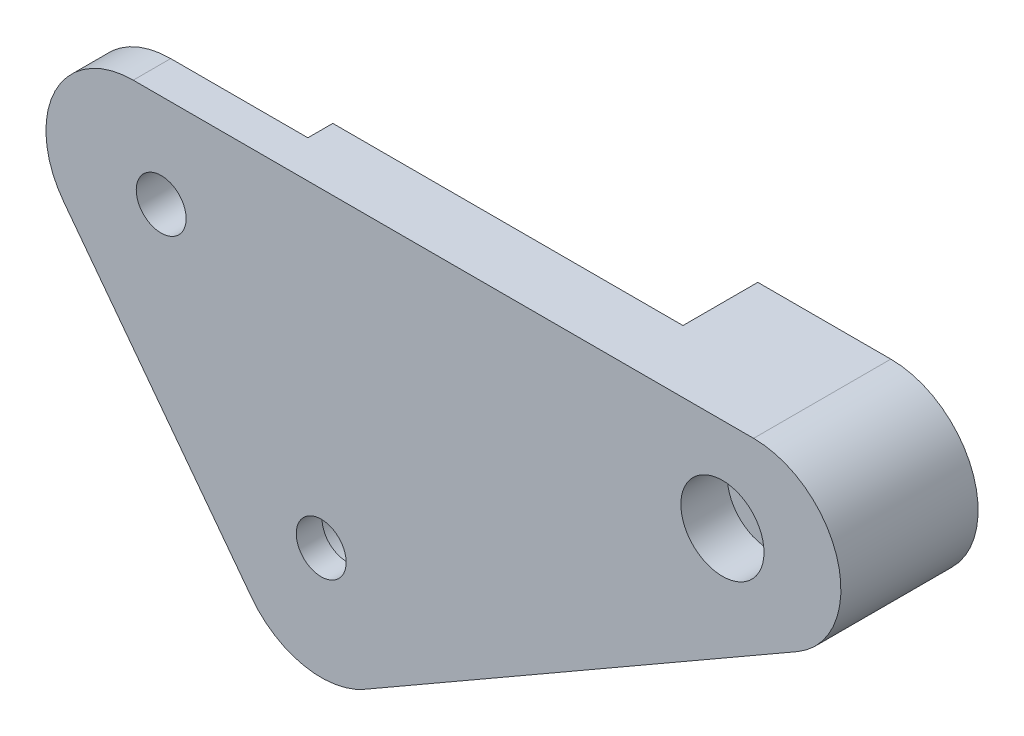
from build123d import *
from build123d.topology import SkipClean

# Parameters (mm, degrees)
SKETCH_1_R          = 3.333333333
SKETCH_1_R_2        = 5
EXTRUDE_1_DEPTH     = 5
EXTRUDE_START       = 6
SKETCH_6_R          = 5
EXTRUDE_5_DEPTH     = 6
EXTRUDE_START_2     = 2
SKETCH_7_R          = 2
EXTRUDE_6_DEPTH     = 2
SKETCH_9_R          = 2
CUT_EXTRUDE_3_DEPTH = 79.745912397
EXTRUDE_START_3     = -11
SKETCH_10_R         = 5
SKETCH_10_R_2       = 2
EXTRUDE_7_DEPTH     = 11
FILLET_2_R          = 10
SCALE_1_SCALE       = 1.5
SKETCH_11_R         = 3
CUT_EXTRUDE_4_DEPTH = 6
EXTRUDE_START_4     = -15
SKETCH_12_R         = 3
SKETCH_12_R_2       = 2.6
EXTRUDE_8_DEPTH     = 15
SKETCH_13_R         = 5
CUT_EXTRUDE_5_DEPTH = 5.6
EXTRUDE_START_5     = -4.4
SKETCH_15_R         = 5
SKETCH_15_R_2       = 3
EXTRUDE_9_DEPTH     = 3.1
SKETCH_16_R         = 6
CUT_EXTRUDE_6_DEPTH = 0.4


with BuildPart() as part:
    # 草图1 → 凸台-拉伸1 (new body)
    with BuildSketch(Plane.XY):
        with BuildLine():
            Line((14.059772875, 0), (63.798276921, 0))
            ThreePointArc((63.798276921, 0), (70.56109353, -5.193259423), (67.289321258, -13.067339568))
            Line((67.289321258, -13.067339568), (32.61880944, -33.016164352))
            ThreePointArc((32.61880944, -33.016164352), (27.731011729, -33.808057978), (23.542094163, -31.167862607))
            Line((23.542094163, -31.167862607), (8.474101936, -11.219037824))
            ThreePointArc((8.474101936, -11.219037824), (7.793463564, -3.88016545), (14.059772875, 0))
        make_face()
        with Locations((29.127765103, -24.948824784)):
            Circle(SKETCH_1_R, mode=Mode.SUBTRACT)
        with Locations((61.298276921, -7.5)):
            Circle(SKETCH_1_R_2, mode=Mode.SUBTRACT)
    extrude(amount=EXTRUDE_1_DEPTH)

    # 草图6 → 凸台-拉伸5 (add)
    with SkipClean():  # the faces are left unmerged after this step: merging them gives an invalid solid
        with BuildSketch(Plane(origin=(0, 0, 0), x_dir=(-1, 0, 0), z_dir=(0, 0, -1)).offset(EXTRUDE_START)):
            with BuildLine():
                Line((-67.289321258, -13.067339568), (-55.111154239, -20.074450433))
                Line((-55.111154239, -20.074450433), (-49.187018483, -12.783115053))
                Line((-49.187018483, -12.783115053), (-53.134085027, 0))
                Line((-53.134085027, 0), (-63.798276921, 0))
                ThreePointArc((-63.798276921, 0), (-70.56109353, -5.193259423), (-67.289321258, -13.067339568))
            make_face()
            with Locations((-61.298276921, -7.5)):
                Circle(SKETCH_6_R, mode=Mode.SUBTRACT)
        extrude(amount=-EXTRUDE_5_DEPTH)

    # 草图7 → 凸台-拉伸6 (add)
    with SkipClean():  # the faces are left unmerged after this step: merging them gives an invalid solid
        with BuildSketch(Plane(origin=(0, 0, 0), x_dir=(-1, 0, 0), z_dir=(0, 0, -1)).offset(EXTRUDE_START_2)):
            with BuildLine():
                Line((-14.059772875, 0), (-25.059772875, 0))
                Line((-25.059772875, 0), (-26.163863889, -10))
                Line((-26.163863889, -10), (-13.040056703, -17.263999238))
                Line((-13.040056703, -17.263999238), (-8.474101936, -11.219037824))
                ThreePointArc((-8.474101936, -11.219037824), (-7.793463564, -3.88016545), (-14.059772875, 0))
            make_face()
            with Locations((-16.298276921, -7.5)):
                Circle(SKETCH_7_R, mode=Mode.SUBTRACT)
        extrude(amount=-EXTRUDE_6_DEPTH)

    # 草图9 → 切除-拉伸3 (cut, through all)
    with SkipClean():  # the faces are left unmerged after this step: merging them gives an invalid solid
        with BuildSketch(Plane(origin=(0, 0, 0), x_dir=(-1, 0, 0), z_dir=(0, 0, -1))):
            with Locations((-16.298276921, -7.5)):
                Circle(SKETCH_9_R)
        extrude(amount=-CUT_EXTRUDE_3_DEPTH, mode=Mode.SUBTRACT)

    # 草图10 → 凸台-拉伸7 (add)
    with BuildSketch(Plane.XY.offset(5).offset(EXTRUDE_START_3)):
        with Locations((61.298276921, -7.5)):
            Circle(SKETCH_10_R)
        with Locations((61.298276921, -7.5)):
            Circle(SKETCH_10_R_2, mode=Mode.SUBTRACT)
    extrude(amount=EXTRUDE_7_DEPTH)

    # 圆角2
    fillet_2_edges = [part.edges().sort_by_distance(p)[0] for p in [
        (49.187018483, -12.783115053, -3),
        (26.163863889, -10, -1),
    ]]
    fillet(fillet_2_edges, radius=FILLET_2_R)


with BuildPart() as part_1:
    # 缩放比例1: scaled about (40.486651363, -11.642315259, 1.295457426)
    add(part.part.scale(SCALE_1_SCALE).moved(Location((-20.243325682, 5.82115763, -0.647728713))))

    # 草图11 → 切除-拉伸4 (cut)
    with BuildSketch(Plane(origin=(0, 0, -3.647728713), x_dir=(-1, 0, 0), z_dir=(0, 0, -1))):
        with BuildLine():
            Line((-17.346333632, 5.82115763), (-17.905962845, 0.752470301))
            ThreePointArc((-17.905962845, 0.752470301), (-15.308702596, -15.14882708), (-4.859629901, -27.41316151))
            Line((-4.859629901, -27.41316151), (7.532172777, -11.007399106))
            ThreePointArc((7.532172777, -11.007399106), (8.553130335, 0.000909454), (-0.846333632, 5.82115763))
            Line((-0.846333632, 5.82115763), (-17.346333632, 5.82115763))
        make_face()
        with Locations((-4.2040897, -5.42884237)):
            Circle(SKETCH_11_R, mode=Mode.SUBTRACT)
    extrude(amount=-CUT_EXTRUDE_4_DEPTH, mode=Mode.SUBTRACT)

    # 草图12 → 凸台-拉伸8 (add)
    with BuildSketch(Plane.XY.offset(6.852271287).offset(EXTRUDE_START_4)):
        with Locations((71.7040897, -5.42884237)):
            Circle(SKETCH_12_R)
        with Locations((71.7040897, -5.42884237)):
            Circle(SKETCH_12_R_2, mode=Mode.SUBTRACT)
    extrude(amount=EXTRUDE_8_DEPTH)

    # 草图13 → 切除-拉伸5 (cut)
    with BuildSketch(Plane.XY.offset(6.852271287)):
        with Locations((71.7040897, -5.42884237)):
            Circle(SKETCH_13_R)
    extrude(amount=-CUT_EXTRUDE_5_DEPTH, mode=Mode.SUBTRACT)

    # 草图15 → 凸台-拉伸9 (add)
    with BuildSketch(Plane(origin=(0, 0, -0.647728713), x_dir=(-1, 0, 0), z_dir=(0, 0, -1)).offset(EXTRUDE_START_5)):
        with Locations((-23.448321972, -31.602079546)):
            Circle(SKETCH_15_R)
        with Locations((-23.448321972, -31.602079546)):
            Circle(SKETCH_15_R_2, mode=Mode.SUBTRACT)
    extrude(amount=-EXTRUDE_9_DEPTH)

    # 草图16 → 切除-拉伸6 (cut)
    with BuildSketch(Plane(origin=(0, 0, -0.647728713), x_dir=(-1, 0, 0), z_dir=(0, 0, -1))):
        with Locations((-23.448321972, -31.602079546)):
            Circle(SKETCH_16_R)
    extrude(amount=-CUT_EXTRUDE_6_DEPTH, mode=Mode.SUBTRACT)


solid = part_1.part
